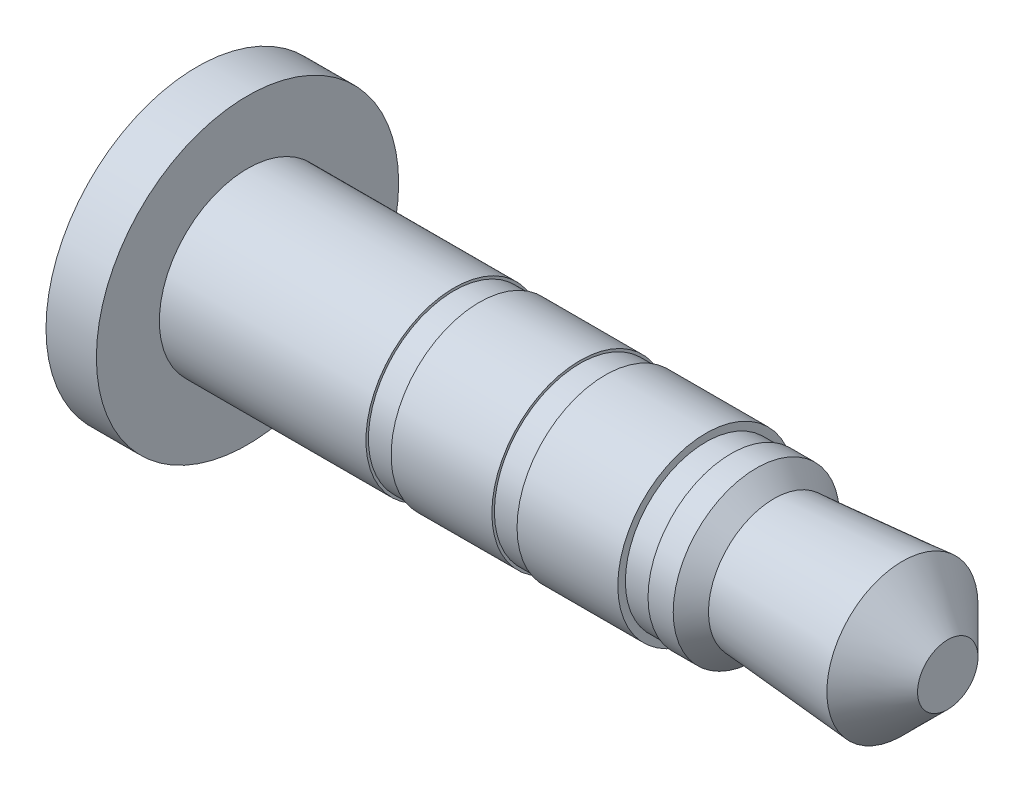
from build123d import *

# Parameters (mm, degrees)
ESQUISSE2_W = 1
ESQUISSE2_H = 0.1
ESQUISSE3_W = 0.5
ESQUISSE3_H = 0.05
ESQUISSE4_W = 0.5
ESQUISSE4_H = 0.05
ESQUISSE5_W = 0.5
ESQUISSE5_H = 0.05


with BuildPart() as part:
    # Esquisse1 → Révolution1 (revolve)
    with BuildSketch(Plane.XY, mode=Mode.PRIVATE) as r_volution1_sk:
        Polygon((0, 0), (0, 1.75), (10, 1.75), (10.45, 1.3), (13, 1.5), (13.9, 0.6), (13.9, 0), align=None)
        Polygon((-1, 0), (0, 0), (0, 1.75), (0, 3), (-1, 3), align=None)
    revolve(r_volution1_sk.sketch.rotate(Axis((13.9, 0, 0), (-1, 0, 0)), 90), axis=Axis((13.9, 0, 0), (-1, 0, 0)))

    # Esquisse2 → End of connector (revolve, cut)
    with BuildSketch(Plane.XY, mode=Mode.PRIVATE) as end_of_connector_sk:
        with Locations((9.6, 1.7)):
            Rectangle(ESQUISSE2_W, ESQUISSE2_H)
    revolve(end_of_connector_sk.sketch.rotate(Axis((0, 0, 0), (1, 0, 0)), 90), axis=Axis((0, 0, 0), (1, 0, 0)), mode=Mode.SUBTRACT)

    # Esquisse3 → First connector separation (revolve, cut)
    with BuildSketch(Plane.XY, mode=Mode.PRIVATE) as first_connector_separation_sk:
        with Locations((9.35, 1.625)):
            Rectangle(ESQUISSE3_W, ESQUISSE3_H)
    revolve(first_connector_separation_sk.sketch.rotate(Axis((13.9, 0, 0), (1, 0, 0)), 90), axis=Axis((13.9, 0, 0), (1, 0, 0)), mode=Mode.SUBTRACT)

    # Esquisse4 → Second connector separation (revolve, cut)
    with BuildSketch(Plane.XY, mode=Mode.PRIVATE) as second_connector_separation_sk:
        with Locations((6.85, 1.725)):
            Rectangle(ESQUISSE4_W, ESQUISSE4_H)
    revolve(second_connector_separation_sk.sketch.rotate(Axis((13.9, 0, 0), (1, 0, 0)), 90), axis=Axis((13.9, 0, 0), (1, 0, 0)), mode=Mode.SUBTRACT)

    # Esquisse5 → Third connector sepatation (revolve, cut)
    with BuildSketch(Plane.XY, mode=Mode.PRIVATE) as third_connector_sepatation_sk:
        with Locations((4.35, 1.725)):
            Rectangle(ESQUISSE5_W, ESQUISSE5_H)
    revolve(third_connector_sepatation_sk.sketch.rotate(Axis((0, 0, 0), (-1, 0, 0)), 90), axis=Axis((0, 0, 0), (-1, 0, 0)), mode=Mode.SUBTRACT)


solid = part.part
